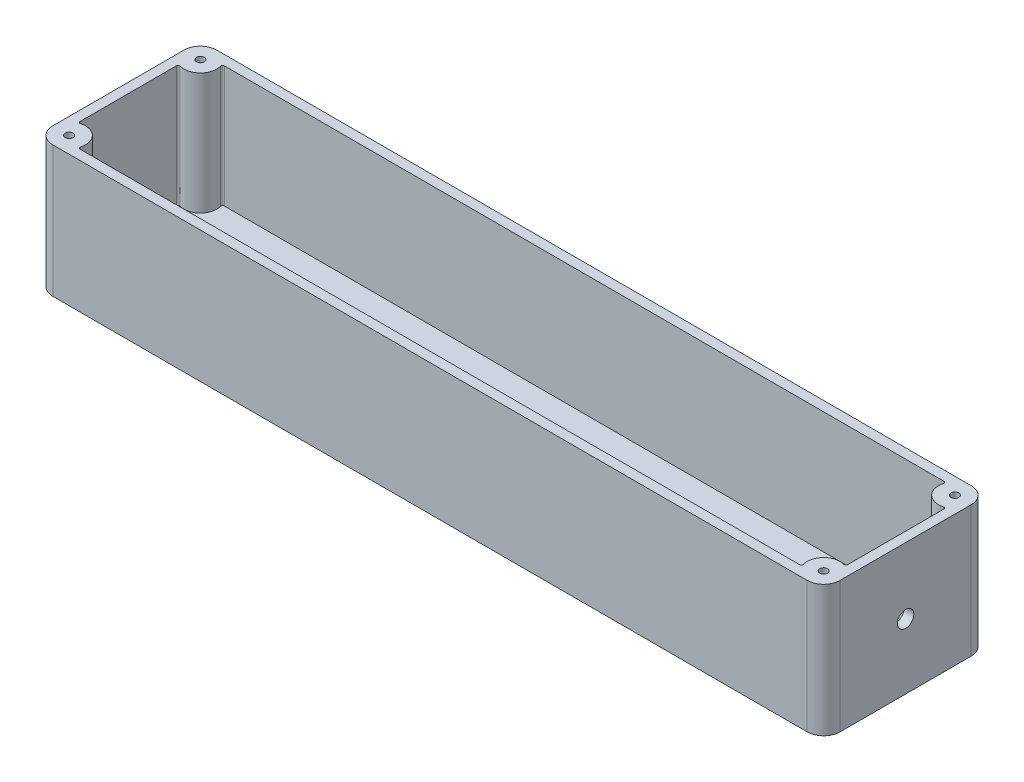
from build123d import *

# Parameters (mm, degrees)
BOSS_EXTRUDE1_DEPTH      = 40
CUT_EXTRUDE1_START       = -37
CUT_EXTRUDE1_DEPTH       = 37
M2_CLEARANCE_HOLE1_D     = 2.4
M2_CLEARANCE_HOLE1_DEPTH = 15
M2_CLEARANCE_HOLE1_TIP   = 0.721032743
SKETCH7_R                = 2.5
CUT_EXTRUDE2_DEPTH       = 7


with BuildPart() as part:
    # Sketch1 → Boss-Extrude1 (new body)
    with BuildSketch(Plane(origin=(0, 0, 0), x_dir=(1, 0, 0), z_dir=(0, 1, 0))):
        with BuildLine():
            Line((-115, 25), (115, 25))
            ThreePointArc((115, 25), (118.535533906, 23.535533906), (120, 20))
            Line((120, 20), (120, -20))
            ThreePointArc((120, -20), (118.535533906, -23.535533906), (115, -25))
            Line((115, -25), (-115, -25))
            ThreePointArc((-115, -25), (-118.535533906, -23.535533906), (-120, -20))
            Line((-120, -20), (-120, 20))
            ThreePointArc((-120, 20), (-118.535533906, 23.535533906), (-115, 25))
        make_face()
    extrude(amount=BOSS_EXTRUDE1_DEPTH)

    # Sketch2 → Cut-Extrude1 (cut)
    with BuildSketch(Plane(origin=(0, 40, 0), x_dir=(1, 0, 0), z_dir=(0, 1, 0)).offset(CUT_EXTRUDE1_START)):
        with BuildLine():
            ThreePointArc((110.189543071, 21.363636364), (111.464466094, 16.464466094), (116.363636364, 15.189543071))
            ThreePointArc((116.363636364, 15.189543071), (116.801511345, 15.107359395), (117, 14.708497378))
            Line((117, 14.708497378), (117, -14.708497378))
            ThreePointArc((117, -14.708497378), (116.801511345, -15.107359395), (116.363636364, -15.189543071))
            ThreePointArc((116.363636364, -15.189543071), (111.464466094, -16.464466094), (110.189543071, -21.363636364))
            ThreePointArc((110.189543071, -21.363636364), (110.107359395, -21.801511345), (109.708497378, -22))
            Line((109.708497378, -22), (-109.708497378, -22))
            ThreePointArc((-109.708497378, -22), (-110.107359395, -21.801511345), (-110.189543071, -21.363636364))
            ThreePointArc((-110.189543071, -21.363636364), (-111.464466094, -16.464466094), (-116.363636364, -15.189543071))
            ThreePointArc((-116.363636364, -15.189543071), (-116.801511345, -15.107359395), (-117, -14.708497378))
            Line((-117, -14.708497378), (-117, 14.708497378))
            ThreePointArc((-117, 14.708497378), (-116.801511345, 15.107359395), (-116.363636364, 15.189543071))
            ThreePointArc((-116.363636364, 15.189543071), (-111.464466094, 16.464466094), (-110.189543071, 21.363636364))
            ThreePointArc((-110.189543071, 21.363636364), (-110.107359395, 21.801511345), (-109.708497378, 22))
            Line((-109.708497378, 22), (109.708497378, 22))
            ThreePointArc((109.708497378, 22), (110.107359395, 21.801511345), (110.189543071, 21.363636364))
        make_face()
    extrude(amount=CUT_EXTRUDE1_DEPTH, mode=Mode.SUBTRACT)

    # M2 Clearance Hole1
    with Locations(Plane(origin=(-115, 40, -20), x_dir=(0, 0, 1), z_dir=(0, 1, 0))):
        with Locations((0, 0), (40, 0), (40, 230), (0, 230)):
            Hole(M2_CLEARANCE_HOLE1_D / 2, depth=M2_CLEARANCE_HOLE1_DEPTH)
            with Locations((0, 0, -(M2_CLEARANCE_HOLE1_DEPTH + M2_CLEARANCE_HOLE1_TIP / 2))):  # 118° drill point
                Cone(0, M2_CLEARANCE_HOLE1_D / 2, M2_CLEARANCE_HOLE1_TIP, mode=Mode.SUBTRACT)

    # Sketch7 → Cut-Extrude2 (cut)
    with BuildSketch(Plane(origin=(120, 0, 0), x_dir=(0, 0, -1), z_dir=(1, 0, 0))):
        with Locations((0, 19.817767005)):
            Circle(SKETCH7_R)
    extrude(amount=-CUT_EXTRUDE2_DEPTH, mode=Mode.SUBTRACT)


solid = part.part
